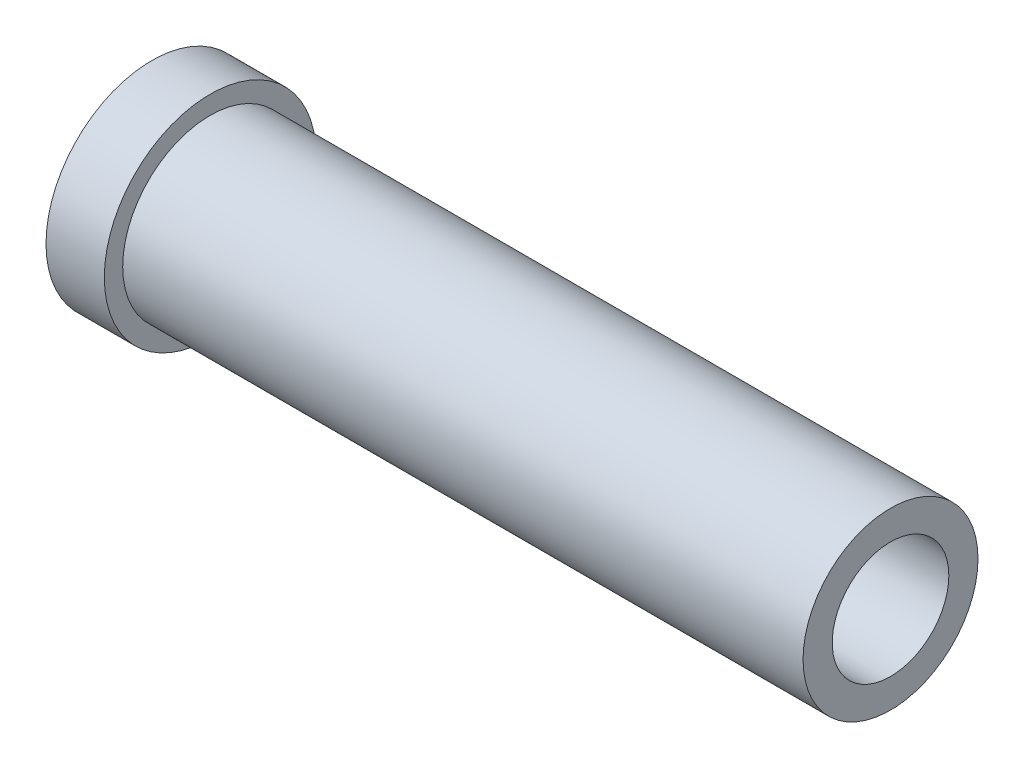
from build123d import *

# Parameters (mm, degrees)
ESQUISSE1_R      = 4.5
ESQUISSE1_R_2    = 3
EXTRUSION1_DEPTH = 38
ESQUISSE2_R      = 5.44549811
ESQUISSE2_R_2    = 4.5
EXTRUSION2_DEPTH = 3


with BuildPart() as part:
    # Esquisse1 → Extrusion1 (new body)
    with BuildSketch(Plane(origin=(0, 0, 0), x_dir=(0, 0, -1), z_dir=(1, 0, 0))):
        Circle(ESQUISSE1_R)
        Circle(ESQUISSE1_R_2, mode=Mode.SUBTRACT)
    extrude(amount=EXTRUSION1_DEPTH)

    # Esquisse2 → Extrusion2 (add)
    with BuildSketch(Plane.ZY):
        Circle(ESQUISSE2_R)
        Circle(ESQUISSE2_R_2, mode=Mode.SUBTRACT)
    extrude(amount=-EXTRUSION2_DEPTH)


solid = part.part
